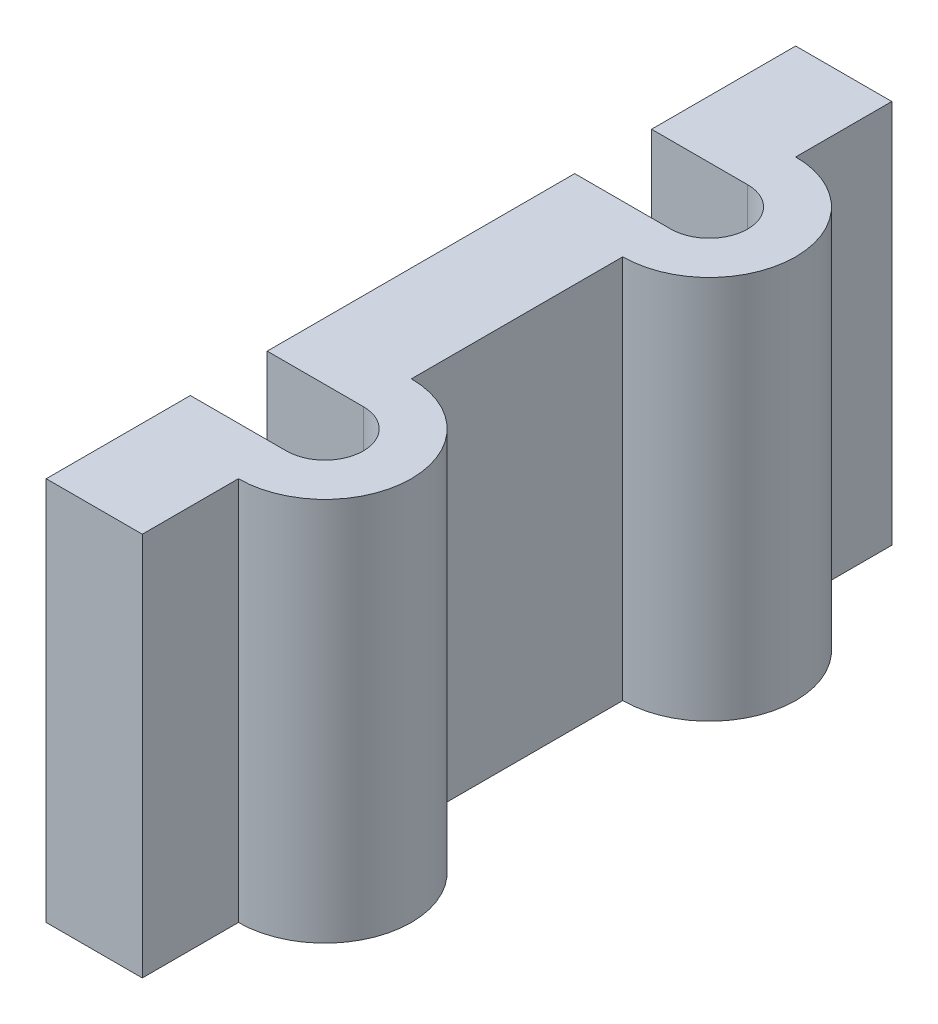
from build123d import *

# Parameters (mm, degrees)
BOSS_EXTRUDE1_DEPTH = 40


with BuildPart() as part:
    # Sketch2 → Boss-Extrude1 (new body)
    with BuildSketch(Plane(origin=(0, 0, 0), x_dir=(1, 0, 0), z_dir=(0, 1, 0))):
        with BuildLine():
            Line((0, 0), (0, 15))
            Line((0, 15), (10, 15))
            ThreePointArc((10, 15), (14, 19), (10, 23))
            Line((10, 23), (0, 23))
            Line((0, 23), (0, 55))
            Line((0, 55), (10, 55))
            ThreePointArc((10, 55), (14, 59), (10, 63))
            Line((10, 63), (0, 63))
            Line((0, 63), (0, 78))
            Line((0, 78), (10, 78))
            Line((10, 78), (10, 68))
            ThreePointArc((10, 68), (19, 59), (10, 50))
            Line((10, 50), (10, 28))
            ThreePointArc((10, 28), (19, 19), (10, 10))
            Line((10, 10), (10, 0))
            Line((10, 0), (0, 0))
        make_face()
    extrude(amount=BOSS_EXTRUDE1_DEPTH)


solid = part.part
